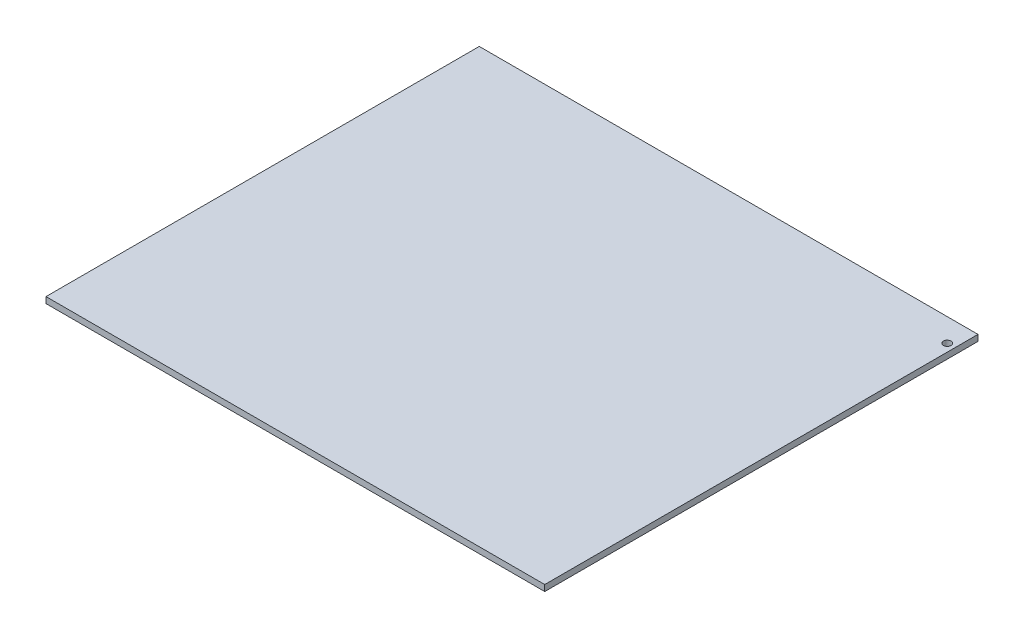
from build123d import *

# Parameters (mm, degrees)
SKETCH1_W            = 259
SKETCH1_H            = 225
BOSS_EXTRUDE1_DEPTH  = 3.175
NEW_MOUNTING_HOLE_R  = 2
NEW_MOUNT_HOLE_DEPTH = 5


with BuildPart() as part:
    # Sketch1 → Boss-Extrude1 (new body)
    with BuildSketch(Plane(origin=(0, 0, 0), x_dir=(1, 0, 0), z_dir=(0, 1, 0))):
        Rectangle(SKETCH1_W, SKETCH1_H)
    extrude(amount=BOSS_EXTRUDE1_DEPTH)

    # New mounting hole → New mount hole (cut, symmetric)
    with BuildSketch(Plane(origin=(0, 3.175, 0), x_dir=(1, 0, 0), z_dir=(0, 1, 0))):
        with Locations(Location((125.5, 100.5, 0), (0, 0, 270))):
            Circle(NEW_MOUNTING_HOLE_R)
    extrude(amount=NEW_MOUNT_HOLE_DEPTH, both=True, mode=Mode.SUBTRACT)


solid = part.part
